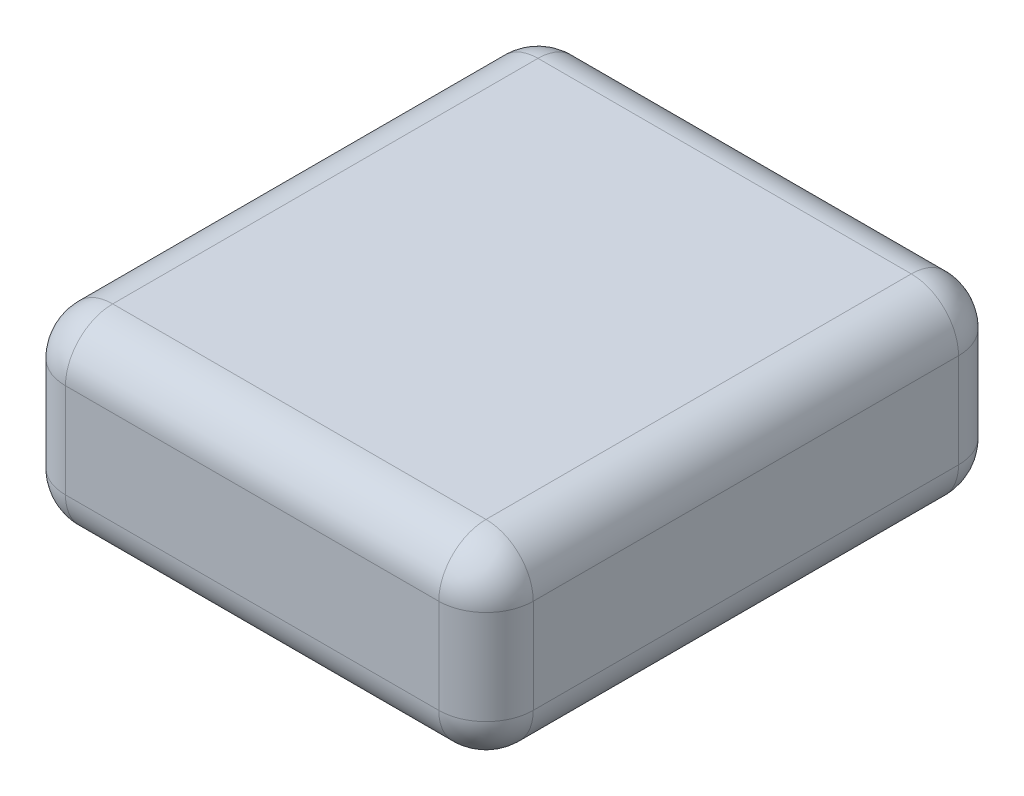
from build123d import *

# Parameters (mm, degrees)
CROQUIS1_W              = 19.8
CROQUIS1_H              = 8
SALIENTE_EXTRUIR1_DEPTH = 22
REDONDEO1_R             = 2


with BuildPart() as part:
    # Croquis1 → Saliente-Extruir1 (new body)
    with BuildSketch(Plane.XY):
        with Locations((-15.200917431, 4)):
            Rectangle(CROQUIS1_W, CROQUIS1_H)
    extrude(amount=SALIENTE_EXTRUIR1_DEPTH)

    # Redondeo1
    redondeo1_edges = [part.edges().sort_by_distance(p)[0] for p in [
        (-5.300917431, 4, 22),
        (-15.200917431, 8, 22),
        (-25.100917431, 4, 22),
        (-15.200917431, 8, 0),
        (-5.300917431, 4, 0),
        (-15.200917431, 0, 0),
        (-25.100917431, 4, 0),
        (-15.200917431, 0, 22),
        (-25.100917431, 8, 11),
        (-5.300917431, 8, 11),
        (-5.300917431, 0, 11),
        (-25.100917431, 0, 11),
    ]]
    fillet(redondeo1_edges, radius=REDONDEO1_R)


solid = part.part
